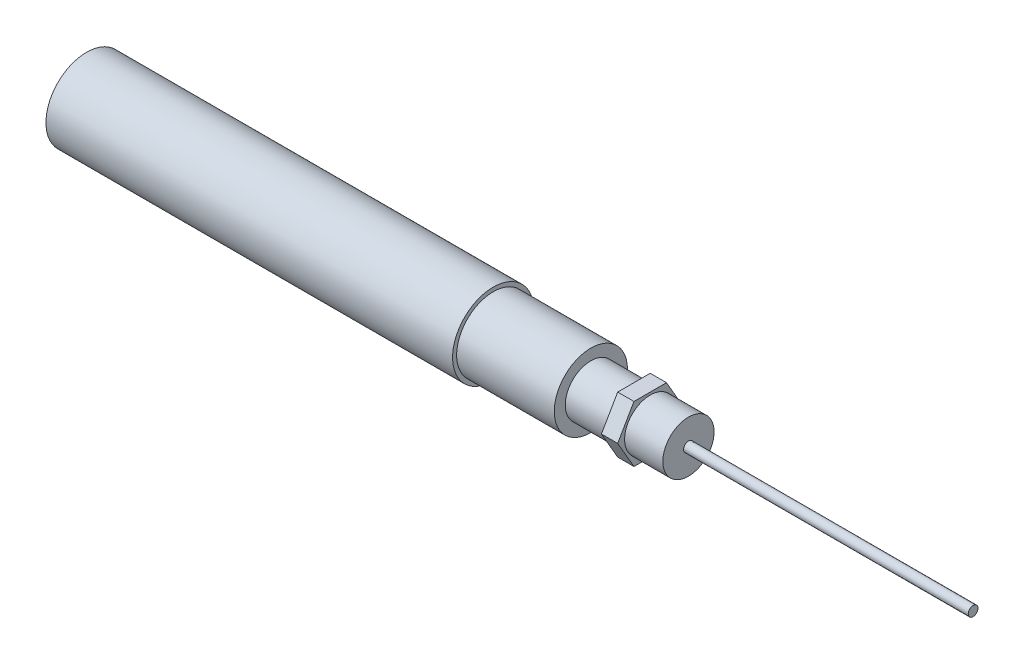
from build123d import *

# Parameters (mm, degrees)
SMA_START          = -2
SK_SMA_BODY_R      = 3.15
SMA_BODY_DEPTH     = 12
SMA_START_2        = 3.3
SK_SMA_NUT_R       = 3.15
SMA_NUT_DEPTH      = 2
ANTENNA_START      = -14
SK_ANTENNA_BASE_R  = 4.5
ANTENNA_BASE_DEPTH = 12
ANTENNA_START_2    = -64
SK_ANTENNA_R       = 5
ANTENNA_DEPTH      = 50
UFL_START          = 10
SK_UFL_PIGTAIL_R   = 0.6
UFL_PIGTAIL_DEPTH  = 35


with BuildPart() as part:
    # SK SMA body → SMA body (new body)
    with BuildSketch(Plane(origin=(0, 0, 0), x_dir=(0, 0, -1), z_dir=(1, 0, 0)).offset(SMA_START)):
        Circle(SK_SMA_BODY_R)
    extrude(amount=SMA_BODY_DEPTH)


with BuildPart() as body_2:
    # SK SMA nut → SMA nut (new body)
    with BuildSketch(Plane(origin=(0, 0, 0), x_dir=(0, 0, -1), z_dir=(1, 0, 0)).offset(SMA_START_2)):
        Polygon((4, 0), (2, 3.464101615), (-2, 3.464101615), (-4, 0), (-2, -3.464101615), (2, -3.464101615), align=None)
        Circle(SK_SMA_NUT_R, mode=Mode.SUBTRACT)
    extrude(amount=SMA_NUT_DEPTH)


with BuildPart() as body_3:
    # SK Antenna base → Antenna base (new body)
    with BuildSketch(Plane(origin=(0, 0, 0), x_dir=(0, 0, -1), z_dir=(1, 0, 0)).offset(ANTENNA_START)):
        Circle(SK_ANTENNA_BASE_R)
    extrude(amount=ANTENNA_BASE_DEPTH)


with BuildPart() as body_4:
    # SK Antenna → Antenna (new body)
    with BuildSketch(Plane(origin=(0, 0, 0), x_dir=(0, 0, -1), z_dir=(1, 0, 0)).offset(ANTENNA_START_2)):
        Circle(SK_ANTENNA_R)
    extrude(amount=ANTENNA_DEPTH)


with BuildPart() as body_5:
    # SK uFL pigtail → uFL pigtail (new body)
    with BuildSketch(Plane(origin=(0, 0, 0), x_dir=(0, 0, -1), z_dir=(1, 0, 0)).offset(UFL_START)):
        Circle(SK_UFL_PIGTAIL_R)
    extrude(amount=UFL_PIGTAIL_DEPTH)


solid = Compound([part.part, body_2.part, body_3.part, body_4.part, body_5.part])
